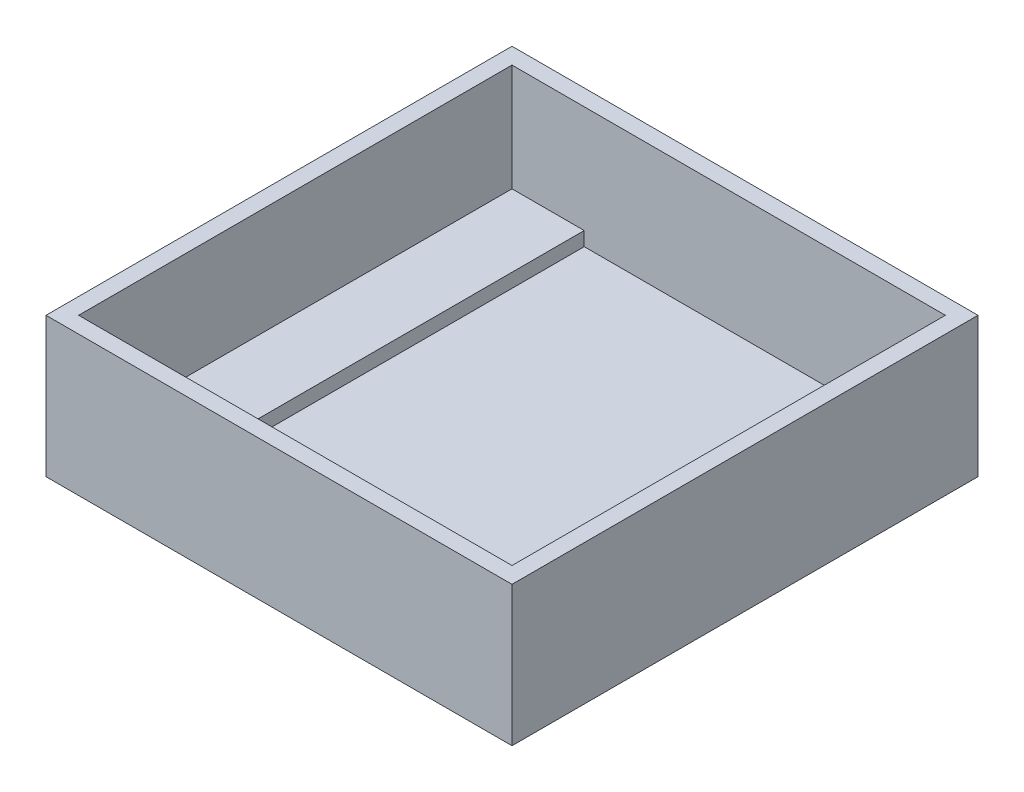
from build123d import *

# Parameters (mm, degrees)
SKETCH1_W           = 1000
SKETCH1_H           = 1000
BOSS_EXTRUDE2_DEPTH = 300
SKETCH1_4_W         = 155
SKETCH1_4_H         = 930
BOSS_EXTRUDE3_DEPTH = 70
SKETCH1_5_W         = 620
SKETCH1_5_H         = 930
BOSS_EXTRUDE4_DEPTH = 40


with BuildPart() as part:
    # Sketch1 → Boss-Extrude2 (new body)
    with BuildSketch(Plane(origin=(0, 0, 0), x_dir=(1, 0, 0), z_dir=(0, 1, 0))):
        Rectangle(SKETCH1_W, SKETCH1_H)
        Polygon((-465, 465), (-310, 465), (310, 465), (465, 465), (465, -465), (310, -465), (-310, -465), (-465, -465), align=None, mode=Mode.SUBTRACT)
    extrude(amount=BOSS_EXTRUDE2_DEPTH)

    # Sketch1<4> → Boss-Extrude3 (add)
    with BuildSketch(Plane(origin=(0, 0, 0), x_dir=(1, 0, 0), z_dir=(0, 1, 0))):
        with Locations((-387.5, 0)):
            Rectangle(SKETCH1_4_W, SKETCH1_4_H)
        with Locations((387.5, 0)):
            Rectangle(SKETCH1_4_W, SKETCH1_4_H)
    extrude(amount=BOSS_EXTRUDE3_DEPTH)

    # Sketch1<5> → Boss-Extrude4 (add)
    with BuildSketch(Plane(origin=(0, 0, 0), x_dir=(1, 0, 0), z_dir=(0, 1, 0))):
        Rectangle(SKETCH1_5_W, SKETCH1_5_H)
    extrude(amount=BOSS_EXTRUDE4_DEPTH)


solid = part.part
